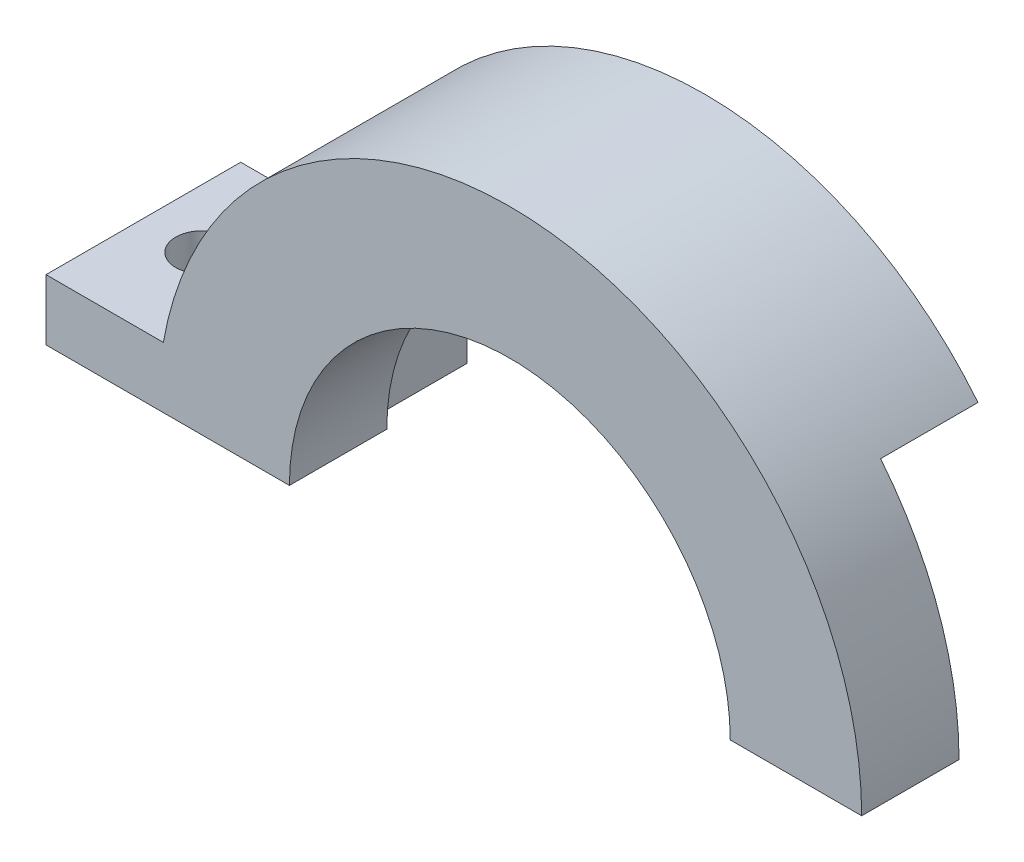
from build123d import *

# Parameters (mm, degrees)
BOSS_EXTRUDE1_DEPTH = 8
BOSS_EXTRUDE2_DEPTH = 8
BOSS_EXTRUDE3_DEPTH = 16
SKETCH4_R           = 2.165
CUT_EXTRUDE1_DEPTH  = 48.748826419
CUT_EXTRUDE2_DEPTH  = 8


with BuildPart() as part:
    # Sketch1 → Boss-Extrude1 (new body)
    with BuildSketch(Plane.XY):
        with BuildLine():
            Line((-19.5, 13.830605225), (-19.5, 0))
            Line((-19.5, 0), (-28.9068116, 0))
            ThreePointArc((-28.9068116, 0), (0, 28.9068116), (28.9068116, 0))
            Line((28.9068116, 0), (23.9068116, 0))
            ThreePointArc((23.9068116, 0), (7.257851427, 22.778481809), (-19.5, 13.830605225))
        make_face()
    extrude(amount=BOSS_EXTRUDE1_DEPTH)

    # Sketch2 → Boss-Extrude2 (add)
    with BuildSketch(Plane.XY.offset(8)):
        with BuildLine():
            Line((-28.9068116, 0), (-18.11056, 0))
            ThreePointArc((-18.11056, 0), (0, 18.11056), (18.11056, 0))
            Line((18.11056, 0), (28.9068116, 0))
            ThreePointArc((28.9068116, 0), (0, 28.9068116), (-28.9068116, 0))
        make_face()
    extrude(amount=BOSS_EXTRUDE2_DEPTH)

    # Sketch3 → Boss-Extrude3 (add, through all)
    with BuildSketch(Plane.XY.offset(16)):
        with BuildLine():
            Line((-28.9068116, 0), (-38.11056, 0))
            Line((-38.11056, 0), (-38.11056, 5))
            Line((-38.11056, 5), (-28.471103893, 5))
            ThreePointArc((-28.471103893, 5), (-28.797678666, 2.509474109), (-28.9068116, 0))
        make_face()
    extrude(amount=-BOSS_EXTRUDE3_DEPTH)

    # Sketch4 → Cut-Extrude1 (cut, through all)
    with BuildSketch(Plane(origin=(0, 5, 0), x_dir=(1, 0, 0), z_dir=(0, 1, 0))):
        with Locations(Location((-33.290831946, -8, 0), (0, 0, 180))):
            Circle(SKETCH4_R)
    extrude(amount=-CUT_EXTRUDE1_DEPTH, mode=Mode.SUBTRACT)

    # Sketch5 → Cut-Extrude2 (cut)
    with BuildSketch(Plane(origin=(0, 0, 0), x_dir=(-1, 0, 0), z_dir=(0, 0, -1))):
        Polygon((0, 0), (-17.347099568, 16.450342776), (-43.024104882, 25.187540913), (-58.13318285, -8.31229871), align=None)
    extrude(amount=-CUT_EXTRUDE2_DEPTH, mode=Mode.SUBTRACT)


solid = part.part
